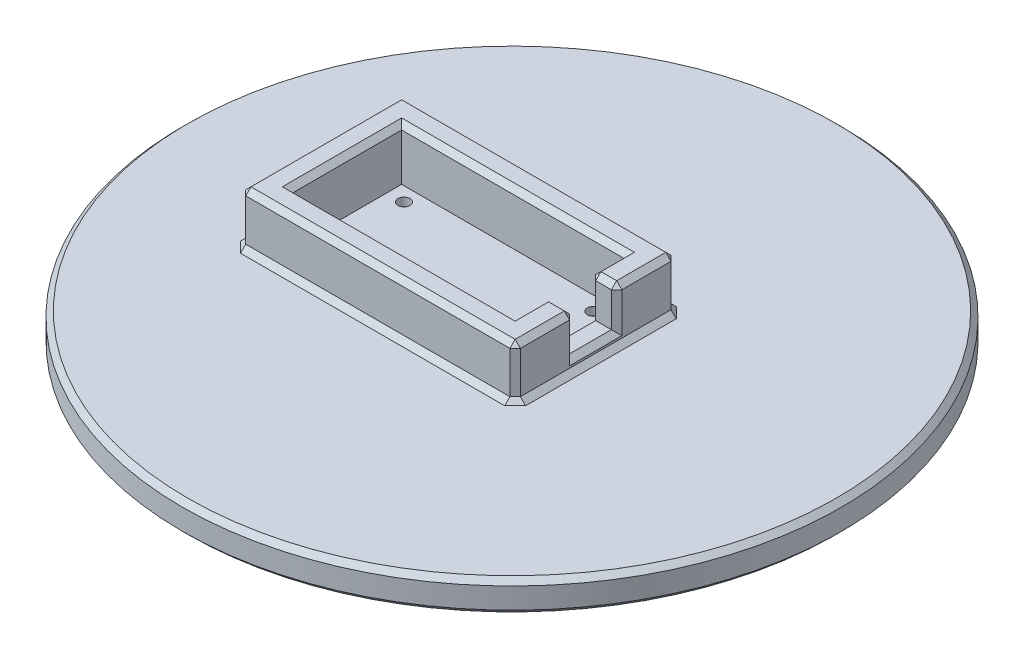
from build123d import *

# Parameters (mm, degrees)
SKETCH1_R           = 63
BOSS_EXTRUDE1_DEPTH = 6
CHAMFER2_SIZE       = 1
SKETCH4_W           = 52.5
SKETCH4_H           = 30.8
SKETCH4_W_2         = 42.5
SKETCH4_H_2         = 20.8
BOSS_EXTRUDE2_DEPTH = 10
SKETCH5_W           = 5
SKETCH5_H           = 8
CUT_EXTRUDE1_DEPTH  = 7.6
SKETCH6_R           = 1.15
CUT_EXTRUDE2_DEPTH  = 90.654893899
SKETCH7_R           = 2.1
CUT_EXTRUDE3_DEPTH  = 4.41
CHAMFER3_SIZE       = 1
CHAMFER4_SIZE       = 0.5


with BuildPart() as part:
    # Sketch1 → Boss-Extrude1 (new body)
    with BuildSketch(Plane(origin=(0, 0, 0), x_dir=(1, 0, 0), z_dir=(0, 1, 0))):
        with Locations(Location((0, 0, 0), (0, 0, 270))):
            Circle(SKETCH1_R)
    extrude(amount=BOSS_EXTRUDE1_DEPTH)

    # Chamfer2
    chamfer2_edges = [part.edges().sort_by_distance(p)[0] for p in [
        (0, 0, -63),
        (0, 6, -63),
    ]]
    chamfer(chamfer2_edges, length=CHAMFER2_SIZE)

    # Sketch4 → Boss-Extrude2 (add)
    with BuildSketch(Plane(origin=(0, 6, 0), x_dir=(1, 0, 0), z_dir=(0, 1, 0))):
        with Locations((-10.25, 0)):
            Rectangle(SKETCH4_W, SKETCH4_H)
        with Locations((-10.25, 0)):
            Rectangle(SKETCH4_W_2, SKETCH4_H_2, mode=Mode.SUBTRACT)
    extrude(amount=BOSS_EXTRUDE2_DEPTH)

    # Sketch5 → Cut-Extrude1 (cut)
    with BuildSketch(Plane(origin=(0, 16, 0), x_dir=(1, 0, 0), z_dir=(0, 1, 0))):
        with Locations((13.5, 0)):
            Rectangle(SKETCH5_W, SKETCH5_H)
    extrude(amount=-CUT_EXTRUDE1_DEPTH, mode=Mode.SUBTRACT)

    # Sketch6 → Cut-Extrude2 (cut, through all)
    with BuildSketch(Plane(origin=(0, 6, 0), x_dir=(1, 0, 0), z_dir=(0, 1, 0))):
        with Locations(Location((-28.35, 7.7, 0), (0, 0, 270))):
            Circle(SKETCH6_R)
        with Locations(Location((7.85, 7.7, 0), (0, 0, 90))):
            Circle(SKETCH6_R)
        with Locations(Location((7.85, -7.7, 0), (0, 0, 270))):
            Circle(SKETCH6_R)
        with Locations(Location((-28.35, -7.7, 0), (0, 0, 90))):
            Circle(SKETCH6_R)
    extrude(amount=-CUT_EXTRUDE2_DEPTH, mode=Mode.SUBTRACT)

    # Sketch7 → Cut-Extrude3 (cut)
    with BuildSketch(Plane.XZ):
        with Locations(Location((-28.35, 7.7, 0), (0, 0, 270))):
            Circle(SKETCH7_R)
        with Locations(Location((7.85, 7.7, 0), (0, 0, 270))):
            Circle(SKETCH7_R)
        with Locations(Location((-28.35, -7.7, 0), (0, 0, 270))):
            Circle(SKETCH7_R)
        with Locations(Location((7.85, -7.7, 0), (0, 0, 270))):
            Circle(SKETCH7_R)
    extrude(amount=-CUT_EXTRUDE3_DEPTH, mode=Mode.SUBTRACT)

    # Chamfer3
    chamfer3_edges = [part.edges().sort_by_distance(p)[0] for p in [
        (16, 16, 9.7),
        (-10.25, 16, -15.4),
        (-36.5, 16, 0),
        (-10.25, 16, 15.4),
        (16, 6, 0),
        (16, 11, 15.4),
        (-10.25, 6, -15.4),
        (16, 11, -15.4),
        (-36.5, 6, 0),
        (-36.5, 11, -15.4),
        (-10.25, 6, 15.4),
        (-36.5, 11, 15.4),
        (11, 16, 7.2),
        (-10.25, 16, -10.4),
        (-31.5, 16, 0),
        (-10.25, 16, 10.4),
        (11, 16, -7.2),
        (16, 16, -9.7),
        (16, 8.4, 0),
        (16, 12.2, -4),
        (16, 12.2, 4),
        (11, 8.4, 0),
        (11, 12.2, 4),
        (11, 12.2, -4),
        (13.5, 16, -4),
        (13.5, 16, 4),
    ]]
    chamfer(chamfer3_edges, length=CHAMFER3_SIZE)

    # Chamfer4
    chamfer4_edges = [part.edges().sort_by_distance(p)[0] for p in [
        (7.85, 0, 9.8),
        (-28.35, 0, -5.6),
        (7.85, 0, -5.6),
        (-28.35, 0, 9.8),
    ]]
    chamfer(chamfer4_edges, length=CHAMFER4_SIZE)


solid = part.part
